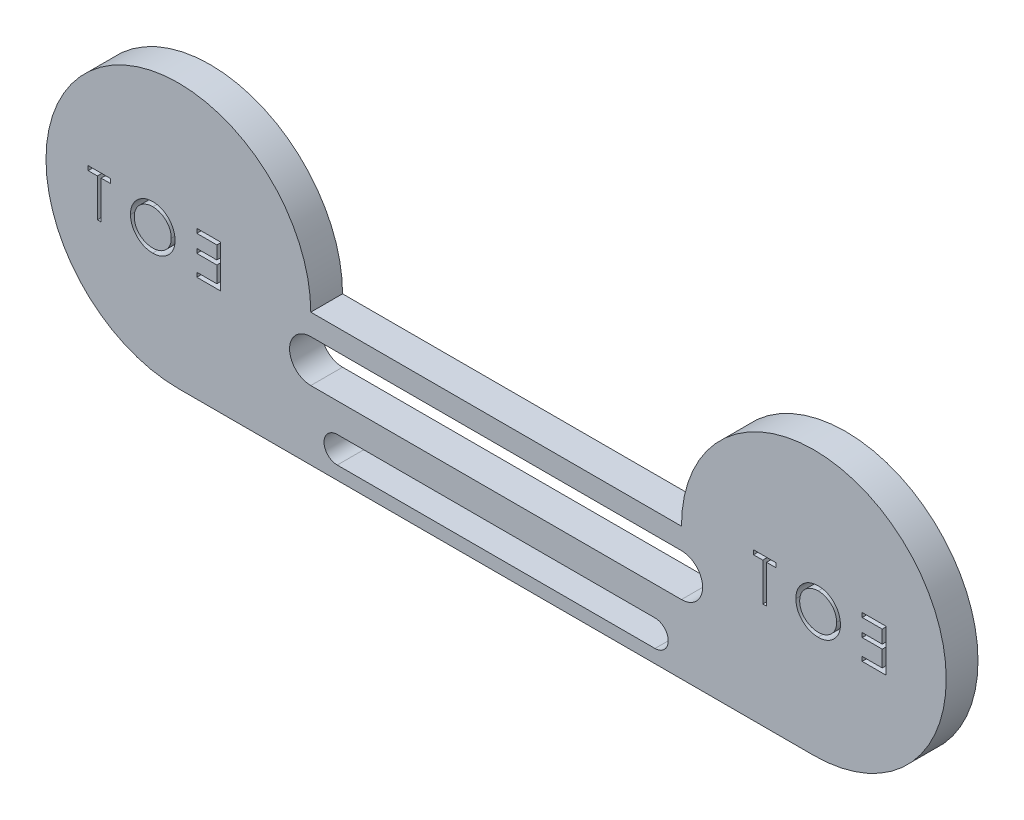
from build123d import *

# Parameters (mm, degrees)
BOSS_EXTRUDE2_DEPTH = 6
CUT_EXTRUDE2_DEPTH  = 6


with BuildPart() as part:
    # Sketch1 → Boss-Extrude2 (new body)
    with BuildSketch(Plane.XY):
        with BuildLine():
            Line((-88.026666667, -23.926666667), (-63.026666667, -23.926666667))
            Line((-63.026666667, -23.926666667), (6.973333333, -23.926666667))
            Line((6.973333333, -23.926666667), (9.119737362, -23.926666667))
            Line((9.119737362, -23.926666667), (31.973333333, -23.926666667))
            ThreePointArc((31.973333333, -23.926666667), (49.651002863, 18.751002863), (6.973333333, 1.073333333))
            Line((6.973333333, 1.073333333), (-63.026666667, 1.073333333))
            ThreePointArc((-63.026666667, 1.073333333), (-105.704336196, 18.751002863), (-88.026666667, -23.926666667))
        make_face()
        with BuildLine():
            ThreePointArc((-58.026666667, -21.426666667), (-60.526666667, -18.926666667), (-58.026666667, -16.426666667))
            Line((-58.026666667, -16.426666667), (1.973333333, -16.426666667))
            ThreePointArc((1.973333333, -16.426666667), (4.473333333, -18.926666667), (1.973333333, -21.426666667))
            Line((1.973333333, -21.426666667), (-58.026666667, -21.426666667))
        make_face(mode=Mode.SUBTRACT)
        with BuildLine():
            ThreePointArc((-63.026666667, -10.926666667), (-67.026666667, -6.926666667), (-63.026666667, -2.926666667))
            Line((-63.026666667, -2.926666667), (6.973333333, -2.926666667))
            ThreePointArc((6.973333333, -2.926666667), (10.973333333, -6.926666667), (6.973333333, -10.926666667))
            Line((6.973333333, -10.926666667), (-63.026666667, -10.926666667))
        make_face(mode=Mode.SUBTRACT)
    extrude(amount=BOSS_EXTRUDE2_DEPTH)

    # Sketch2 → Cut-Extrude2 (cut)
    # profile 1 of 6: a face of its own
    with BuildSketch(Plane(origin=(0, 0, 0), x_dir=(-1, 0, 0), z_dir=(0, 0, -1))):
        Polygon((80.043494999, 4.023420816), (84.556315512, 4.023420816), (84.556315512, 3.202907995), (80.761443717, 3.202907995), (80.761443717, 0.741369534), (84.556315512, 0.741369534), (84.556315512, -0.079143287), (80.761443717, -0.079143287), (80.761443717, -3.156066364), (84.556315512, -3.156066364), (84.556315512, -3.976579184), (80.043494999, -3.976579184), align=None)
    # profile 2 of 6: a face of its own
    with BuildSketch(Plane(origin=(0, 0, 0), x_dir=(-1, 0, 0), z_dir=(0, 0, -1))):
        with BuildLine():
            add(Edge.make_bspline(
                [(92.812725768, 4.228549021), (92.960858581, 4.224797068), (93.251803649, 4.217427923), (93.679403415, 4.161018544), (94.087620776, 4.063429081), (94.479781093, 3.93345655), (94.851193611, 3.760075097), (95.204653937, 3.550509044), (95.539321077, 3.302562852), (95.850684234, 3.018153191), (96.135614407, 2.708705296), (96.386645004, 2.378470073), (96.597027389, 2.02944424), (96.769794903, 1.662676627), (96.905334582, 1.2789967), (96.998863825, 0.876358979), (97.058608168, 0.457372259), (97.065592802, 0.171596568), (97.069136024, 0.026625944)],
                knots=[0, 0, 0, 0, 1.065120563, 2.091984664, 3.0946048, 4.079830382, 5.057816894, 6.036188127, 7.030412546, 8.04752943, 9.064399622, 10.05169764, 11.02544977, 11.989514704, 12.962713494, 13.945757189, 14.957906945, 16, 16, 16, 16], degree=3))
            add(Edge.make_bspline(
                [(97.069136024, 0.026625944), (97.065593321, -0.11727679), (97.058610244, -0.400925751), (96.998795895, -0.817253624), (96.904987895, -1.21746093), (96.771053572, -1.600879565), (96.599109622, -1.967913996), (96.387326373, -2.317598462), (96.137860749, -2.650047602), (95.853959375, -2.961619408), (95.544471279, -3.247327912), (95.212516383, -3.496285342), (94.865560223, -3.710511913), (94.499138033, -3.881446025), (94.118109378, -4.018067557), (93.719064068, -4.111216426), (93.303871944, -4.171301096), (93.020738221, -4.178200561), (92.876828332, -4.181707389)],
                knots=[0, 0, 0, 0, 1.043624062, 2.057103931, 3.04512605, 4.022047818, 4.998200453, 5.980619268, 6.982898556, 8.009068085, 9.034988726, 10.034168286, 11.015286542, 11.987931943, 12.962482838, 13.94673481, 14.956375938, 16, 16, 16, 16], degree=3))
            add(Edge.make_bspline(
                [(92.876828332, -4.181707389), (92.73185846, -4.178165934), (92.446084252, -4.171184782), (92.026571029, -4.111341571), (91.623650471, -4.017761448), (91.238474811, -3.884025594), (90.870829258, -3.711186209), (90.519994783, -3.500433343), (90.187379589, -3.250359877), (89.875741312, -2.966550564), (89.590600287, -2.657587016), (89.342007429, -2.32653729), (89.13120717, -1.979896247), (88.958948124, -1.616701906), (88.822572217, -1.238710037), (88.729532633, -0.843399231), (88.669336171, -0.433023218), (88.662399379, -0.153610879), (88.658879614, -0.011835594)],
                knots=[0, 0, 0, 0, 1.053102029, 2.075944431, 3.073151272, 4.055350789, 5.033113405, 6.020478099, 7.024410459, 8.052272461, 9.079885166, 10.07527673, 11.055994387, 12.023226415, 12.992069828, 13.970394897, 14.97016774, 16, 16, 16, 16], degree=3))
            add(Edge.make_bspline(
                [(88.658879614, -0.011835594), (88.660101638, 0.083324792), (88.66253027, 0.272445075), (88.691768424, 0.553283018), (88.73419517, 0.829604521), (88.794999541, 1.100623831), (88.874523351, 1.36567751), (88.968356557, 1.62659354), (89.082961918, 1.880727765), (89.212517685, 2.129284089), (89.357116103, 2.368387874), (89.516832102, 2.59439835), (89.686055801, 2.809212057), (89.871572129, 3.007262351), (90.067266861, 3.194310709), (90.276314583, 3.367482633), (90.497439713, 3.528339664), (90.731593724, 3.673300444), (90.973006923, 3.804407037), (91.22186813, 3.916914125), (91.474797436, 4.013476551), (91.732979488, 4.091741295), (91.995728682, 4.153528805), (92.263618475, 4.195602757), (92.536435449, 4.224915483), (92.72023275, 4.227332631), (92.812725768, 4.228549021)],
                knots=[0, 0, 0, 0, 1.037015668, 2.060948919, 3.074880161, 4.083647147, 5.086022904, 6.090072063, 7.104153813, 8.122640571, 9.144368836, 10.147691507, 11.138137339, 12.123020368, 13.103399296, 14.087645067, 15.080126199, 16.082011238, 17.087798457, 18.072939717, 19.057185487, 20.037253025, 21.01195951, 21.997135196, 22.992090687, 24, 24, 24, 24], degree=3))
        make_face()
        with BuildLine():
            add(Edge.make_bspline(
                [(92.847982178, 3.408036201), (92.772063016, 3.407110737), (92.620950483, 3.405268658), (92.396300115, 3.381004165), (92.174604266, 3.346421562), (91.955817153, 3.297092371), (91.740854205, 3.229883108), (91.527711711, 3.152532461), (91.318333302, 3.058312825), (91.113410199, 2.951860929), (90.91474717, 2.834034824), (90.727289567, 2.703813643), (90.550552095, 2.564251233), (90.384967485, 2.41502189), (90.231021949, 2.255365658), (90.085685488, 2.087702947), (89.954783587, 1.907241481), (89.834816555, 1.718874837), (89.727461491, 1.522848366), (89.631997823, 1.321225823), (89.55390866, 1.112362539), (89.490223229, 0.898524465), (89.437423661, 0.680050271), (89.403974692, 0.455282617), (89.379443584, 0.225350932), (89.377706795, 0.069963837), (89.376828332, -0.008630466)],
                knots=[0, 0, 0, 0, 1.008559885, 2.007477868, 2.99961109, 3.989939068, 4.984837346, 5.991145699, 7.001802488, 8.033829008, 9.059044045, 10.069351652, 11.065060232, 12.050310815, 13.029377138, 14.011219647, 14.996725999, 15.989392538, 16.977580475, 17.965360261, 18.951710183, 19.937753436, 20.929683414, 21.935841486, 22.955955122, 24, 24, 24, 24], degree=3))
            add(Edge.make_bspline(
                [(89.376828332, -0.008630466), (89.379742302, -0.124201257), (89.385474983, -0.351564754), (89.435663715, -0.684749083), (89.512971085, -1.004950881), (89.62693078, -1.310418102), (89.76944647, -1.603776463), (89.945507934, -1.882423559), (90.154100129, -2.1464347), (90.391045333, -2.393966744), (90.650068662, -2.619900011), (90.925114902, -2.818216373), (91.213237434, -2.98601123), (91.515187611, -3.122708538), (91.829353415, -3.231027939), (92.157759246, -3.30526481), (92.498217439, -3.354122994), (92.730287508, -3.358815007), (92.847982178, -3.361194569)],
                knots=[0, 0, 0, 0, 1.032063989, 2.030389145, 3.003944642, 3.970395727, 4.937377036, 5.913328081, 6.909231446, 7.93887556, 8.970685674, 9.976071282, 10.964166581, 11.944589148, 12.933237628, 13.927779006, 14.949070134, 16, 16, 16, 16], degree=3))
            add(Edge.make_bspline(
                [(92.847982178, -3.361194569), (92.927089611, -3.360107702), (93.083983408, -3.357952118), (93.317344602, -3.336240856), (93.546501657, -3.301425155), (93.771133154, -3.251297942), (93.990984152, -3.18856147), (94.206972273, -3.11402952), (94.416796937, -3.021043912), (94.623105137, -2.918305737), (94.820582261, -2.801185377), (95.009097764, -2.675383892), (95.183900003, -2.536027045), (95.349360738, -2.389014902), (95.503938313, -2.231383249), (95.646587419, -2.063337028), (95.776827722, -1.883815526), (95.8967492, -1.695734598), (96.003728086, -1.499171735), (96.096937455, -1.296818186), (96.176014291, -1.089172221), (96.239850874, -0.875934344), (96.289874786, -0.657509546), (96.324343175, -0.433605368), (96.348453891, -0.204669728), (96.350271211, -0.049826628), (96.351187306, 0.028228508)],
                knots=[0, 0, 0, 0, 1.047197238, 2.076906641, 3.100256066, 4.114471768, 5.12198147, 6.126382909, 7.136867548, 8.15857795, 9.17633901, 10.174870724, 11.156907918, 12.133735059, 13.104061851, 14.077631395, 15.04955518, 16.038496417, 17.029181396, 18.010275684, 18.986308667, 19.968651475, 20.955262928, 21.950658345, 22.966943676, 24, 24, 24, 24], degree=3))
            add(Edge.make_bspline(
                [(96.351187306, 0.028228508), (96.350270477, 0.105749661), (96.348451776, 0.259527147), (96.324354691, 0.48686616), (96.289838371, 0.709159215), (96.240095038, 0.925533622), (96.175980401, 1.136044536), (96.096923646, 1.340494245), (96.003700104, 1.539644406), (95.896709877, 1.733002799), (95.776445137, 1.918545057), (95.645029724, 2.095922), (95.500194643, 2.261802552), (95.346078014, 2.420281852), (95.178830276, 2.567979886), (94.999209033, 2.704945647), (94.809394912, 2.83448456), (94.608418374, 2.951342987), (94.401003623, 3.059261233), (94.188171719, 3.151720669), (93.972333777, 3.230285513), (93.754038663, 3.297295719), (93.531448998, 3.346228359), (93.306068818, 3.38103533), (93.078209941, 3.405260212), (92.924968296, 3.407107935), (92.847982178, 3.408036201)],
                knots=[0, 0, 0, 0, 1.02996197, 2.043119294, 3.035359645, 4.018872909, 4.991431989, 5.957985074, 6.929999688, 7.912076566, 8.892894881, 9.867085534, 10.843653904, 11.817741046, 12.803660682, 13.806313499, 14.818574707, 15.856120519, 16.894564902, 17.924820532, 18.937903209, 19.946497019, 20.957711757, 21.963978472, 22.977135795, 24, 24, 24, 24], degree=3))
        make_face(mode=Mode.SUBTRACT)
    # profile 3 of 6: a face of its own
    with BuildSketch(Plane(origin=(0, 0, 0), x_dir=(-1, 0, 0), z_dir=(0, 0, -1))):
        Polygon((100.864007819, 3.202907995), (100.864007819, 4.023420816), (105.069136024, 4.023420816), (105.069136024, 3.202907995), (103.325546281, 3.202907995), (103.325546281, -3.976579184), (102.607597563, -3.976579184), (102.607597563, 3.202907995), align=None)
    # profile 4 of 6: a face of its own
    with BuildSketch(Plane(origin=(0, 0, 0), x_dir=(-1, 0, 0), z_dir=(0, 0, -1))):
        Polygon((-45.608731389, 4.023420816), (-41.095910876, 4.023420816), (-41.095910876, 3.202907995), (-44.890782671, 3.202907995), (-44.890782671, 0.741369534), (-41.095910876, 0.741369534), (-41.095910876, -0.079143287), (-44.890782671, -0.079143287), (-44.890782671, -3.156066364), (-41.095910876, -3.156066364), (-41.095910876, -3.976579184), (-45.608731389, -3.976579184), align=None)
    # profile 5 of 6: a face of its own
    with BuildSketch(Plane(origin=(0, 0, 0), x_dir=(-1, 0, 0), z_dir=(0, 0, -1))):
        with BuildLine():
            add(Edge.make_bspline(
                [(-32.83950062, 4.228549021), (-32.691367806, 4.224797068), (-32.400422739, 4.217427923), (-31.972822973, 4.161018544), (-31.564605612, 4.063429081), (-31.172445295, 3.93345655), (-30.801032777, 3.760075097), (-30.447572451, 3.550509044), (-30.112905311, 3.302562852), (-29.801542153, 3.018153191), (-29.516611981, 2.708705296), (-29.265581384, 2.378470073), (-29.055198998, 2.02944424), (-28.882431485, 1.662676627), (-28.746891805, 1.2789967), (-28.653362563, 0.876358979), (-28.593618219, 0.457372259), (-28.586633585, 0.171596568), (-28.583090363, 0.026625944)],
                knots=[0, 0, 0, 0, 1.065120563, 2.091984664, 3.0946048, 4.079830382, 5.057816894, 6.036188127, 7.030412546, 8.04752943, 9.064399622, 10.05169764, 11.02544977, 11.989514704, 12.962713494, 13.945757189, 14.957906945, 16, 16, 16, 16], degree=3))
            add(Edge.make_bspline(
                [(-28.583090363, 0.026625944), (-28.586633066, -0.11727679), (-28.593616144, -0.400925751), (-28.653430493, -0.817253624), (-28.747238493, -1.21746093), (-28.881172815, -1.600879565), (-29.053116766, -1.967913996), (-29.264900014, -2.317598462), (-29.514365639, -2.650047602), (-29.798267013, -2.961619408), (-30.107755109, -3.247327912), (-30.439710004, -3.496285342), (-30.786666164, -3.710511913), (-31.153088354, -3.881446025), (-31.53411701, -4.018067557), (-31.93316232, -4.111216426), (-32.348354443, -4.171301096), (-32.631488166, -4.178200561), (-32.775398055, -4.181707389)],
                knots=[0, 0, 0, 0, 1.043624062, 2.057103931, 3.04512605, 4.022047818, 4.998200453, 5.980619268, 6.982898556, 8.009068085, 9.034988726, 10.034168286, 11.015286542, 11.987931943, 12.962482838, 13.94673481, 14.956375938, 16, 16, 16, 16], degree=3))
            add(Edge.make_bspline(
                [(-32.775398055, -4.181707389), (-32.920367927, -4.178165934), (-33.206142135, -4.171184782), (-33.625655359, -4.111341571), (-34.028575916, -4.017761448), (-34.413751576, -3.884025594), (-34.78139713, -3.711186209), (-35.132231604, -3.500433343), (-35.464846798, -3.250359877), (-35.776485076, -2.966550564), (-36.0616261, -2.657587016), (-36.310218959, -2.32653729), (-36.521019218, -1.979896247), (-36.693278264, -1.616701906), (-36.829654171, -1.238710037), (-36.922693755, -0.843399231), (-36.982890217, -0.433023218), (-36.989827009, -0.153610879), (-36.993346773, -0.011835594)],
                knots=[0, 0, 0, 0, 1.053102029, 2.075944431, 3.073151272, 4.055350789, 5.033113405, 6.020478099, 7.024410459, 8.052272461, 9.079885166, 10.07527673, 11.055994387, 12.023226415, 12.992069828, 13.970394897, 14.97016774, 16, 16, 16, 16], degree=3))
            add(Edge.make_bspline(
                [(-36.993346773, -0.011835594), (-36.992124749, 0.083324792), (-36.989696118, 0.272445075), (-36.960457964, 0.553283018), (-36.918031218, 0.829604521), (-36.857226846, 1.100623831), (-36.777703036, 1.36567751), (-36.683869831, 1.62659354), (-36.56926447, 1.880727765), (-36.439708703, 2.129284089), (-36.295110285, 2.368387874), (-36.135394286, 2.59439835), (-35.966170586, 2.809212057), (-35.780654258, 3.007262351), (-35.584959526, 3.194310709), (-35.375911805, 3.367482633), (-35.154786675, 3.528339664), (-34.920632664, 3.673300444), (-34.679219464, 3.804407037), (-34.430358258, 3.916914125), (-34.177428952, 4.013476551), (-33.919246899, 4.091741295), (-33.656497706, 4.153528805), (-33.388607913, 4.195602757), (-33.115790938, 4.224915483), (-32.931993638, 4.227332631), (-32.83950062, 4.228549021)],
                knots=[0, 0, 0, 0, 1.037015668, 2.060948919, 3.074880161, 4.083647147, 5.086022904, 6.090072063, 7.104153813, 8.122640571, 9.144368836, 10.147691507, 11.138137339, 12.123020368, 13.103399296, 14.087645067, 15.080126199, 16.082011238, 17.087798457, 18.072939717, 19.057185487, 20.037253025, 21.01195951, 21.997135196, 22.992090687, 24, 24, 24, 24], degree=3))
        make_face()
        with BuildLine():
            add(Edge.make_bspline(
                [(-32.804244209, 3.408036201), (-32.880163372, 3.407110737), (-33.031275904, 3.405268658), (-33.255926273, 3.381004165), (-33.477622121, 3.346421562), (-33.696409235, 3.297092371), (-33.911372182, 3.229883108), (-34.124514676, 3.152532461), (-34.333893085, 3.058312825), (-34.538816189, 2.951860929), (-34.737479218, 2.834034824), (-34.924936821, 2.703813643), (-35.101674293, 2.564251233), (-35.267258902, 2.41502189), (-35.421204439, 2.255365658), (-35.566540899, 2.087702947), (-35.6974428, 1.907241481), (-35.817409833, 1.718874837), (-35.924764896, 1.522848366), (-36.020228564, 1.321225823), (-36.098317727, 1.112362539), (-36.162003159, 0.898524465), (-36.214802727, 0.680050271), (-36.248251696, 0.455282617), (-36.272782803, 0.225350932), (-36.274519593, 0.069963837), (-36.275398055, -0.008630466)],
                knots=[0, 0, 0, 0, 1.008559885, 2.007477868, 2.99961109, 3.989939068, 4.984837346, 5.991145699, 7.001802488, 8.033829008, 9.059044045, 10.069351652, 11.065060232, 12.050310815, 13.029377138, 14.011219647, 14.996725999, 15.989392538, 16.977580475, 17.965360261, 18.951710183, 19.937753436, 20.929683414, 21.935841486, 22.955955122, 24, 24, 24, 24], degree=3))
            add(Edge.make_bspline(
                [(-36.275398055, -0.008630466), (-36.272484085, -0.124201257), (-36.266751404, -0.351564754), (-36.216562673, -0.684749083), (-36.139255303, -1.004950881), (-36.025295608, -1.310418102), (-35.882779917, -1.603776463), (-35.706718454, -1.882423559), (-35.498126258, -2.1464347), (-35.261181055, -2.393966744), (-35.002157725, -2.619900011), (-34.727111485, -2.818216373), (-34.438988954, -2.98601123), (-34.137038776, -3.122708538), (-33.822872973, -3.231027939), (-33.494467142, -3.30526481), (-33.154008949, -3.354122994), (-32.92193888, -3.358815007), (-32.804244209, -3.361194569)],
                knots=[0, 0, 0, 0, 1.032063989, 2.030389145, 3.003944642, 3.970395727, 4.937377036, 5.913328081, 6.909231446, 7.93887556, 8.970685674, 9.976071282, 10.964166581, 11.944589148, 12.933237628, 13.927779006, 14.949070134, 16, 16, 16, 16], degree=3))
            add(Edge.make_bspline(
                [(-32.804244209, -3.361194569), (-32.725136777, -3.360107702), (-32.56824298, -3.357952118), (-32.334881786, -3.336240856), (-32.10572473, -3.301425155), (-31.881093233, -3.251297942), (-31.661242236, -3.18856147), (-31.445254115, -3.11402952), (-31.235429451, -3.021043912), (-31.02912125, -2.918305737), (-30.831644126, -2.801185377), (-30.643128624, -2.675383892), (-30.468326384, -2.536027045), (-30.30286565, -2.389014902), (-30.148288075, -2.231383249), (-30.005638968, -2.063337028), (-29.875398666, -1.883815526), (-29.755477188, -1.695734598), (-29.648498302, -1.499171735), (-29.555288933, -1.296818186), (-29.476212096, -1.089172221), (-29.412375514, -0.875934344), (-29.362351601, -0.657509546), (-29.327883213, -0.433605368), (-29.303772496, -0.204669728), (-29.301955177, -0.049826628), (-29.301039081, 0.028228508)],
                knots=[0, 0, 0, 0, 1.047197238, 2.076906641, 3.100256066, 4.114471768, 5.12198147, 6.126382909, 7.136867548, 8.15857795, 9.17633901, 10.174870724, 11.156907918, 12.133735059, 13.104061851, 14.077631395, 15.04955518, 16.038496417, 17.029181396, 18.010275684, 18.986308667, 19.968651475, 20.955262928, 21.950658345, 22.966943676, 24, 24, 24, 24], degree=3))
            add(Edge.make_bspline(
                [(-29.301039081, 0.028228508), (-29.301955911, 0.105749661), (-29.303774611, 0.259527147), (-29.327871696, 0.48686616), (-29.362388017, 0.709159215), (-29.41213135, 0.925533622), (-29.476245987, 1.136044536), (-29.555302742, 1.340494245), (-29.648526284, 1.539644406), (-29.755516511, 1.733002799), (-29.87578125, 1.918545057), (-30.007196663, 2.095922), (-30.152031745, 2.261802552), (-30.306148373, 2.420281852), (-30.473396111, 2.567979886), (-30.653017355, 2.704945647), (-30.842831475, 2.83448456), (-31.043808013, 2.951342987), (-31.251222765, 3.059261233), (-31.464054669, 3.151720669), (-31.679892611, 3.230285513), (-31.898187725, 3.297295719), (-32.120777389, 3.346228359), (-32.34615757, 3.38103533), (-32.574016446, 3.405260212), (-32.727258091, 3.407107935), (-32.804244209, 3.408036201)],
                knots=[0, 0, 0, 0, 1.02996197, 2.043119294, 3.035359645, 4.018872909, 4.991431989, 5.957985074, 6.929999688, 7.912076566, 8.892894881, 9.867085534, 10.843653904, 11.817741046, 12.803660682, 13.806313499, 14.818574707, 15.856120519, 16.894564902, 17.924820532, 18.937903209, 19.946497019, 20.957711757, 21.963978472, 22.977135795, 24, 24, 24, 24], degree=3))
        make_face(mode=Mode.SUBTRACT)
    # profile 6 of 6: a face of its own
    with BuildSketch(Plane(origin=(0, 0, 0), x_dir=(-1, 0, 0), z_dir=(0, 0, -1))):
        Polygon((-24.788218568, 3.202907995), (-24.788218568, 4.023420816), (-20.583090363, 4.023420816), (-20.583090363, 3.202907995), (-22.326680107, 3.202907995), (-22.326680107, -3.976579184), (-23.044628825, -3.976579184), (-23.044628825, 3.202907995), align=None)
    extrude(amount=-CUT_EXTRUDE2_DEPTH, mode=Mode.SUBTRACT)


with BuildPart() as cut_extrude2_piece_1:
    # of the separate pieces the step leaves, piece 1, a body of its own (cut_extrude2_pieces)
    add(part.part.solids().sort_by_distance((-63.026666667, 1.073333333, 0))[0])


with BuildPart() as cut_extrude2_piece_2:
    # of the separate pieces the step leaves, piece 2, a body of its own (cut_extrude2_pieces)
    add(part.part.solids().sort_by_distance((32.804244209, 3.408036201, 0))[0])


with BuildPart() as cut_extrude2_piece_3:
    # of the separate pieces the step leaves, piece 3, a body of its own (cut_extrude2_pieces)
    add(part.part.solids().sort_by_distance((-92.847982178, 3.408036201, 0))[0])


solid = Compound([cut_extrude2_piece_1.part, cut_extrude2_piece_2.part, cut_extrude2_piece_3.part])
